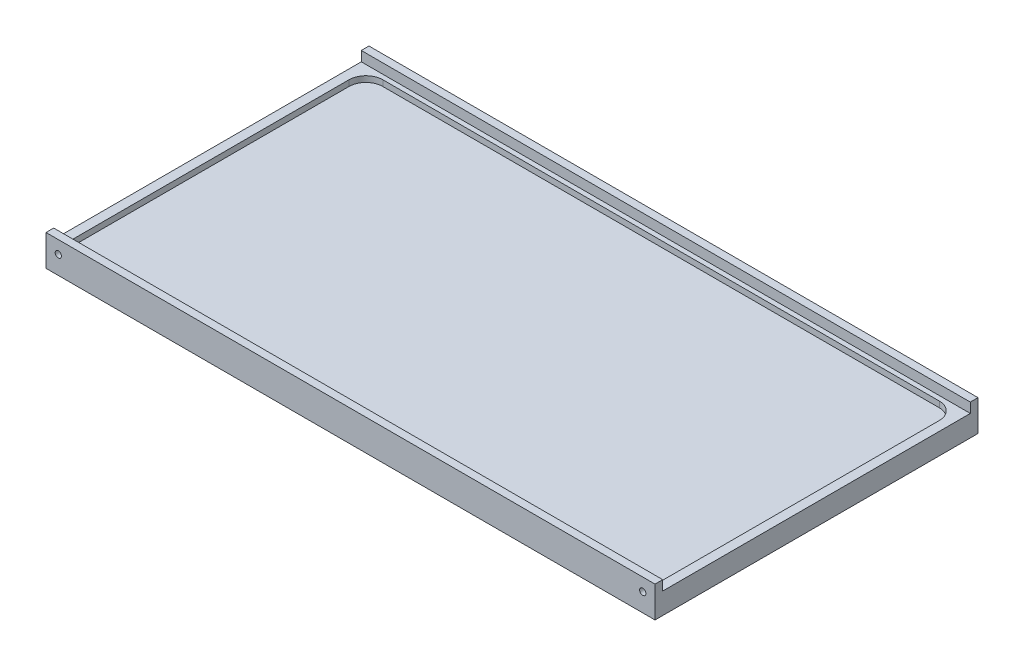
from build123d import *

# Parameters (mm, degrees)
BOSS_EXTRUDE1_DEPTH = 1009.525
SKETCH3_W           = 1919.05
SKETCH3_H           = 40.475
BOSS_EXTRUDE2_DEPTH = 19.05
FILLET1_R           = 55
BOSS_EXTRUDE4_START = -50
SKETCH4_W           = 2000
SKETCH4_H           = 40.475
BOSS_EXTRUDE4_DEPTH = 69.05
BOSS_EXTRUDE6_START = 19.05
SKETCH6_W           = 2000
SKETCH6_H           = 25
BOSS_EXTRUDE6_DEPTH = 32
CUT_EXTRUDE5_START  = 1050
SKETCH5_R           = 10.16
CUT_EXTRUDE5_DEPTH  = 25
SKETCH7_W           = 10
SKETCH7_H           = 101.05
CUT_EXTRUDE6_DEPTH  = 1451.89837773


with BuildPart() as part:
    # Sketch2 → Boss-Extrude1 (new body)
    with BuildSketch(Plane.XY):
        Polygon((-959.525, 0), (959.525, 0), (959.525, 19.05), (1000, 19.05), (1000, -50), (-1000, -50), (-1000, 19.05), (-959.525, 19.05), align=None)
    extrude(amount=BOSS_EXTRUDE1_DEPTH)

    # Sketch3 → Boss-Extrude2 (add)
    with BuildSketch(Plane(origin=(0, 0, 0), x_dir=(1, 0, 0), z_dir=(0, 1, 0))):
        with Locations((0, -20.2375)):
            Rectangle(SKETCH3_W, SKETCH3_H)
    extrude(amount=BOSS_EXTRUDE2_DEPTH)

    # Fillet1
    fillet1_edges = [part.edges().sort_by_distance(p)[0] for p in [
        (959.525, 9.525, 40.475),
        (-959.525, 9.525, 40.475),
    ]]
    fillet(fillet1_edges, radius=FILLET1_R)

    # Sketch4 → Boss-Extrude4 (add)
    with BuildSketch(Plane(origin=(0, 0, 0), x_dir=(1, 0, 0), z_dir=(0, 1, 0)).offset(BOSS_EXTRUDE4_START)):
        with Locations((0, -1029.7625)):
            Rectangle(SKETCH4_W, SKETCH4_H)
    extrude(amount=BOSS_EXTRUDE4_DEPTH)

    # Sketch6 → Boss-Extrude6 (add)
    with BuildSketch(Plane(origin=(0, 0, 0), x_dir=(1, 0, 0), z_dir=(0, 1, 0)).offset(BOSS_EXTRUDE6_START)):
        with Locations((0, -12.5)):
            Rectangle(SKETCH6_W, SKETCH6_H)
        with Locations((0, -1037.5)):
            Rectangle(SKETCH6_W, SKETCH6_H)
    extrude(amount=BOSS_EXTRUDE6_DEPTH)

    # Sketch5 → Cut-Extrude5 (cut)
    with BuildSketch(Plane.XY.offset(CUT_EXTRUDE5_START)):
        with Locations(Location((-950, 9.525, 0), (0, 0, 69.635865194))):
            Circle(SKETCH5_R)
        with Locations(Location((950, 9.525, 0), (0, 0, 69.635865194))):
            Circle(SKETCH5_R)
    extrude(amount=-CUT_EXTRUDE5_DEPTH, mode=Mode.SUBTRACT)

    # Sketch7 → Cut-Extrude6 (cut, through all)
    with BuildSketch(Plane.XY):
        with Locations((-995, 0.525)):
            Rectangle(SKETCH7_W, SKETCH7_H)
        with Locations((995, 0.525)):
            Rectangle(SKETCH7_W, SKETCH7_H)
    extrude(amount=CUT_EXTRUDE6_DEPTH, mode=Mode.SUBTRACT)


solid = part.part
